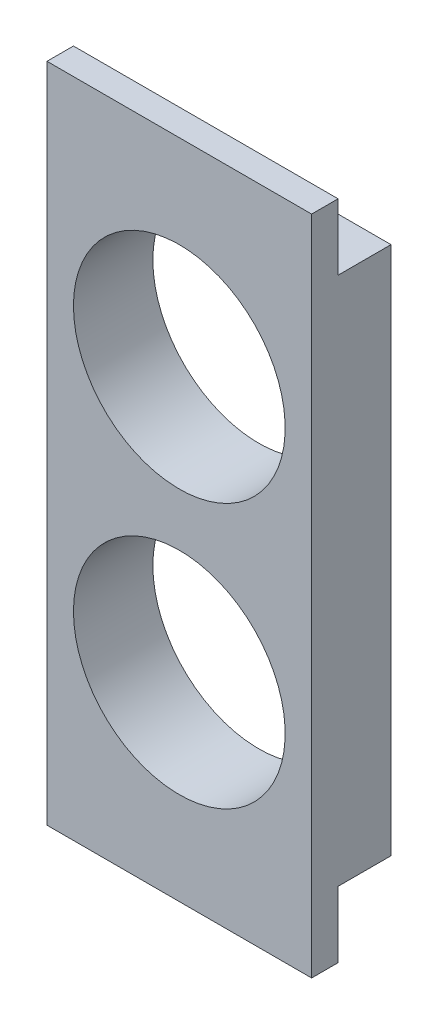
from build123d import *

# Parameters (mm, degrees)
SKETCH_1_W          = 100
SKETCH_1_H          = 200
SKETCH_1_R          = 40
EXTRUDE_1_DEPTH     = 20
SKETCH_2_W          = 100
SKETCH_2_H          = 250
EXTRUDE_2_DEPTH     = 10
SKETCH_3_R          = 40
CUT_EXTRUDE_1_DEPTH = 137.106575888


with BuildPart() as part:
    # 草图1 → 凸台-拉伸1 (new body)
    with BuildSketch(Plane.XY):
        Rectangle(SKETCH_1_W, SKETCH_1_H)
        with Locations((0, 50)):
            Circle(SKETCH_1_R, mode=Mode.SUBTRACT)
        with Locations(Location((0, -50, 0), (0, 0, 180))):
            Circle(SKETCH_1_R, mode=Mode.SUBTRACT)
    extrude(amount=EXTRUDE_1_DEPTH)

    # 草图2 → 凸台-拉伸2 (add)
    with BuildSketch(Plane.XY.offset(20)):
        Rectangle(SKETCH_2_W, SKETCH_2_H)
    extrude(amount=EXTRUDE_2_DEPTH)

    # 草图3 → 切除-拉伸1 (cut, through all)
    with BuildSketch(Plane(origin=(0, 0, 20), x_dir=(-1, 0, 0), z_dir=(0, 0, -1))):
        with Locations((0, 50)):
            Circle(SKETCH_3_R)
        with Locations((0, -50)):
            Circle(SKETCH_3_R)
    extrude(amount=-CUT_EXTRUDE_1_DEPTH, mode=Mode.SUBTRACT)


solid = part.part
